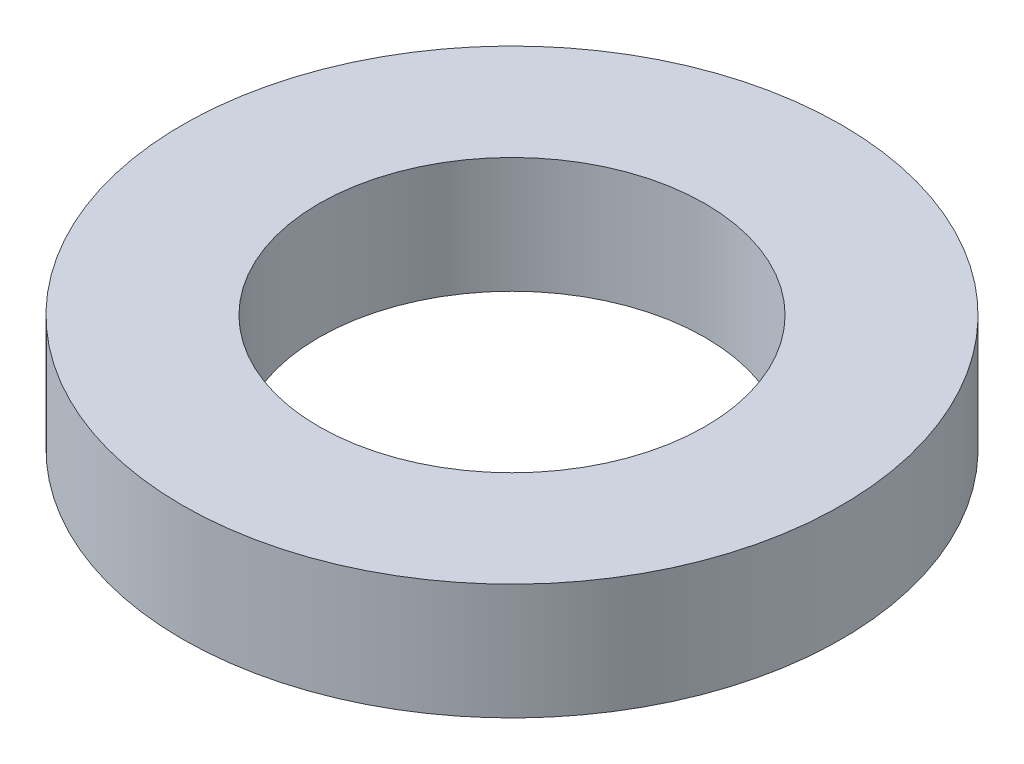
from build123d import *

# Parameters (mm, degrees)
SKETCH1_R           = 12.8
SKETCH1_R_2         = 7.5
BOSS_EXTRUDE1_DEPTH = 4.5


with BuildPart() as part:
    # Sketch1 → Boss-Extrude1 (new body)
    with BuildSketch(Plane(origin=(0, 0, 0), x_dir=(1, 0, 0), z_dir=(0, 1, 0))):
        with Locations(Location((0, 0, 0), (0, 0, 270))):
            Circle(SKETCH1_R)
        with Locations(Location((0, 0, 0), (0, 0, 270))):
            Circle(SKETCH1_R_2, mode=Mode.SUBTRACT)
    extrude(amount=BOSS_EXTRUDE1_DEPTH)


solid = part.part
